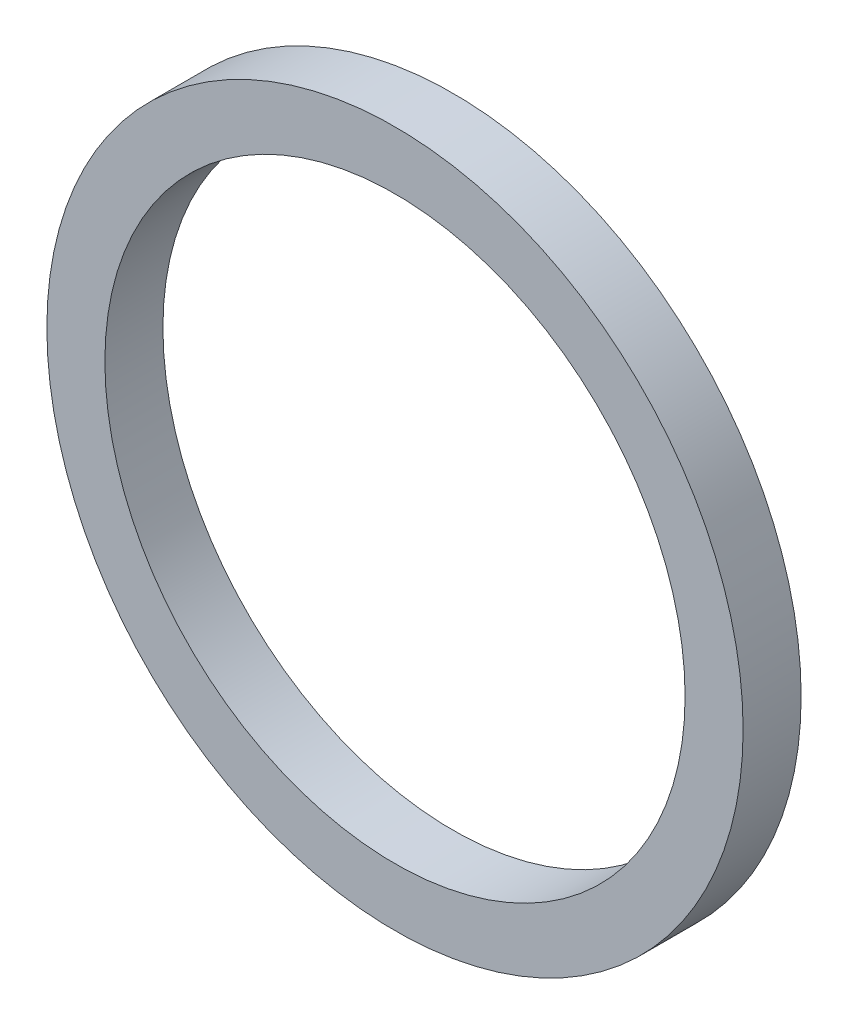
from build123d import *

# Parameters (mm, degrees)
SKETCH_1_R      = 6
SKETCH_1_R_2    = 5
EXTRUDE_1_DEPTH = 1


with BuildPart() as part:
    # 草图1 → 凸台-拉伸1 (new body)
    with BuildSketch(Plane.XY):
        Circle(SKETCH_1_R)
        Circle(SKETCH_1_R_2, mode=Mode.SUBTRACT)
    extrude(amount=EXTRUDE_1_DEPTH)


solid = part.part
